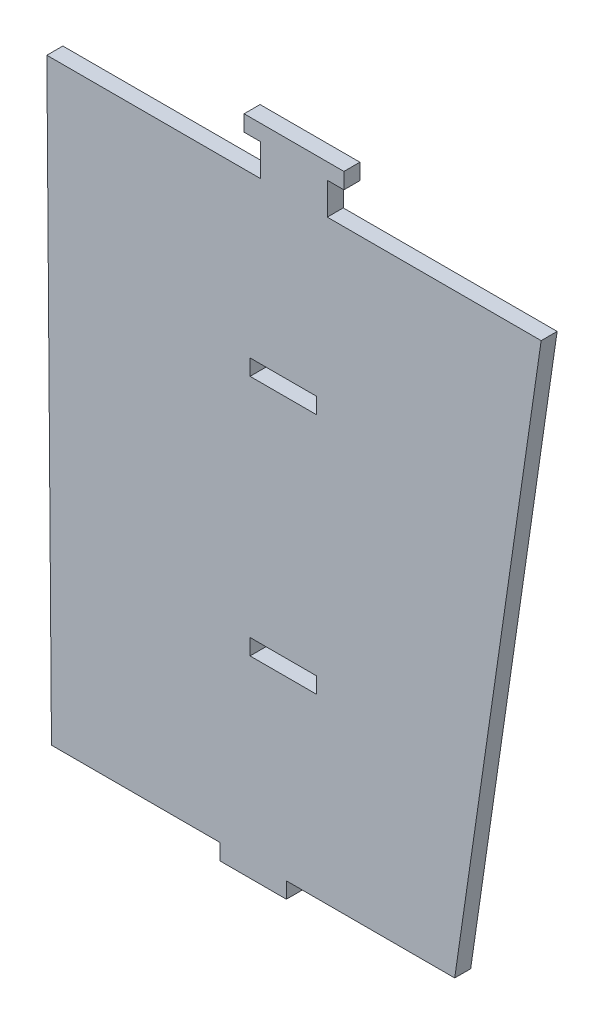
from build123d import *

# Parameters (mm, degrees)
BOSS_EXTRUDE1_DEPTH = 1.524
SKETCH2_W           = 6.35
SKETCH2_H           = 1.524
CUT_EXTRUDE1_DEPTH  = 1.524


with BuildPart() as part:
    # Sketch1 → Boss-Extrude1 (new body)
    with BuildSketch(Plane.XY):
        Polygon((-102.477755775, -1.524), (-110.726395883, -58.314338926), (-126.787898899, -58.314338926), (-126.787898899, -59.838338926), (-133.137898899, -59.838338926), (-133.137898899, -58.314338926), (-149.199401915, -58.314338926), (-149.6392871, -1.524), (-129.233521437, -1.524), (-129.233521437, 1.524), (-130.821021437, 1.524), (-130.821021437, 3.048), (-121.296021437, 3.048), (-121.296021437, 1.524), (-122.883521437, 1.524), (-122.883521437, -1.524), align=None)
    extrude(amount=BOSS_EXTRUDE1_DEPTH)

    # Sketch2 → Cut-Extrude1 (cut)
    with BuildSketch(Plane.XY.offset(1.524)):
        with Locations((-127.078752717, -40.703047377)):
            Rectangle(SKETCH2_W, SKETCH2_H)
        with Locations((-127.078752717, -17.602011312)):
            Rectangle(SKETCH2_W, SKETCH2_H)
    extrude(amount=-CUT_EXTRUDE1_DEPTH, mode=Mode.SUBTRACT)


solid = part.part
